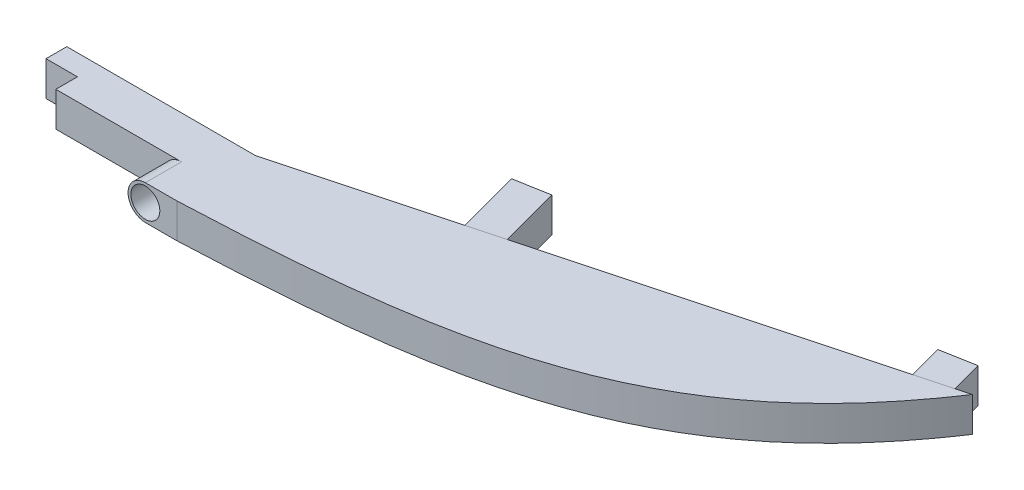
from build123d import *

# Parameters (mm, degrees)
SALIENTE_EXTRUIR1_DEPTH   = 5.5
CROQUIS3_W                = 12.5
CROQUIS3_H                = 5.5
SALIENTE_EXTRUIR2_DEPTH   = 25
CROQUIS4_R                = 2.3
CORTAR_EXTRUIR3_DEPTH     = 12.5
CORTAR_EXTRUIR2_DEPTH     = 5.75
CROQUIS6_W                = 3.3125
CROQUIS6_H                = 5.5
SALIENTE_EXTRUIR3_DEPTH   = 5
SALIENTE_EXTRUIR6_DEPTH   = 5.5
SALIENTE_EXTRUIR6_2_DEPTH = 5.5


with BuildPart() as part:
    # Croquis2 → Saliente-Extruir1 (new body)
    with BuildSketch(Plane(origin=(0, 0, 0), x_dir=(1, 0, 0), z_dir=(0, 1, 0))):
        with BuildLine():
            Line((0, 0), (0, 12.5))
            Line((0, 12.5), (90, 36.615427319))
            add(Edge.make_bspline(
                [(0, 0), (0.391394635, 0.015775005), (1.186974035, 0.048775969), (2.973718865, 0.125104104), (4.540088904, 0.200260299), (6.566615662, 0.300718996), (8.325276336, 0.397659311), (10.239345298, 0.508699867), (12.06569896, 0.624646025), (14.401457649, 0.783062706), (17.174575564, 0.991527453), (20.424315772, 1.267095632), (24.124041131, 1.631890725), (28.746499447, 2.160588299), (34.186717026, 2.916408992), (39.59920567, 3.869463595), (44.959442778, 5.077074293), (49.361815827, 6.280418231), (52.910692092, 7.400878923), (56.408168852, 8.673928793), (59.841449897, 10.111450972), (63.196917977, 11.722972852), (66.459987179, 13.514457641), (69.616669404, 15.487724177), (72.654216734, 17.639793831), (75.562633469, 19.963554552), (78.411401775, 22.516402339), (80.637238299, 24.750127709), (82.31420302, 26.576865179), (83.500174761, 27.941909388), (84.166451521, 28.729544399), (84.824720597, 29.529498585), (85.467901785, 30.330572576), (86.10961807, 31.152932899), (86.725824802, 31.959637263), (87.359215775, 32.814913902), (87.935303716, 33.605334305), (88.585351463, 34.5293994), (89.07725637, 35.234721433), (89.639386065, 36.072003958), (89.880241627, 36.43386466), (90, 36.615427319)],
                knots=[0.074542826, 0.074542826, 0.074542826, 0.074542826, 0.074542826, 0.089942005, 0.105341185, 0.120740364, 0.136139543, 0.151538723, 0.166937902, 0.182337082, 0.197736262, 0.22853462, 0.259332978, 0.290131335, 0.320929692, 0.382526405, 0.441205382, 0.472003704, 0.502802054, 0.533600416, 0.564398766, 0.595197066, 0.625995423, 0.656793872, 0.687592091, 0.718390433, 0.749188737, 0.779987363, 0.814189109, 0.822739652, 0.831290195, 0.839840738, 0.848391281, 0.856941796, 0.865492311, 0.874042825, 0.88259334, 0.891143874, 0.899694409, 0.908244943, 0.916795477, 0.916795477, 0.916795477, 0.916795477, 0.916795477], degree=4))
        make_face()
    extrude(amount=SALIENTE_EXTRUIR1_DEPTH)

    # Croquis3 → Saliente-Extruir2 (add)
    with BuildSketch(Plane.ZY):
        with Locations((-6.25, 2.75)):
            Rectangle(CROQUIS3_W, CROQUIS3_H)
    extrude(amount=SALIENTE_EXTRUIR2_DEPTH)

    # Croquis4 → Cortar-Extruir3 (cut)
    with BuildSketch(Plane(origin=(0, 0, -12.5), x_dir=(-1, 0, 0), z_dir=(0, 0, -1))):
        with Locations((5, 2.75)):
            Circle(CROQUIS4_R)
    extrude(amount=-CORTAR_EXTRUIR3_DEPTH, mode=Mode.SUBTRACT)

    # Croquis5 → Cortar-Extruir2 (cut)
    with BuildSketch(Plane.XY):
        with BuildLine():
            Line((-16, 5.5), (-25, 5.5))
            Line((-25, 5.5), (-25, 0))
            Line((-25, 0), (-5, 0))
            ThreePointArc((-5, 0), (-7.75, 2.75), (-5, 5.5))
            Line((-5, 5.5), (-16, 5.5))
        make_face()
    extrude(amount=-CORTAR_EXTRUIR2_DEPTH, mode=Mode.SUBTRACT)

    # Croquis6 → Saliente-Extruir3 (add)
    with BuildSketch(Plane.ZY.offset(25)):
        with Locations((-10.84375, 2.75)):
            Rectangle(CROQUIS6_W, CROQUIS6_H)
    extrude(amount=SALIENTE_EXTRUIR3_DEPTH)


with BuildPart() as body_2:
    # Croquis9 → Saliente-Extruir6 (new body)
    with BuildSketch(Plane(origin=(0, 5.5, 0), x_dir=(1, 0, 0), z_dir=(0, 1, 0))):
        Polygon((81.052969303, 40.062499841), (82.514074846, 34.60957972), (87.826666891, 36.033084468), (86.484084799, 41.043669048), align=None)
    extrude(amount=-SALIENTE_EXTRUIR6_DEPTH)


with BuildPart() as body_3:
    # Croquis9 → Saliente-Extruir6 2 (new body)
    with BuildSketch(Plane(origin=(0, 5.5, 0), x_dir=(1, 0, 0), z_dir=(0, 1, 0))):
        Polygon((23.606721454, 29.684431199), (26.321478766, 19.552818979), (31.634070811, 20.976323727), (29.03783695, 30.665600406), align=None)
    extrude(amount=-SALIENTE_EXTRUIR6_2_DEPTH)


solid = Compound([part.part, body_2.part, body_3.part])
